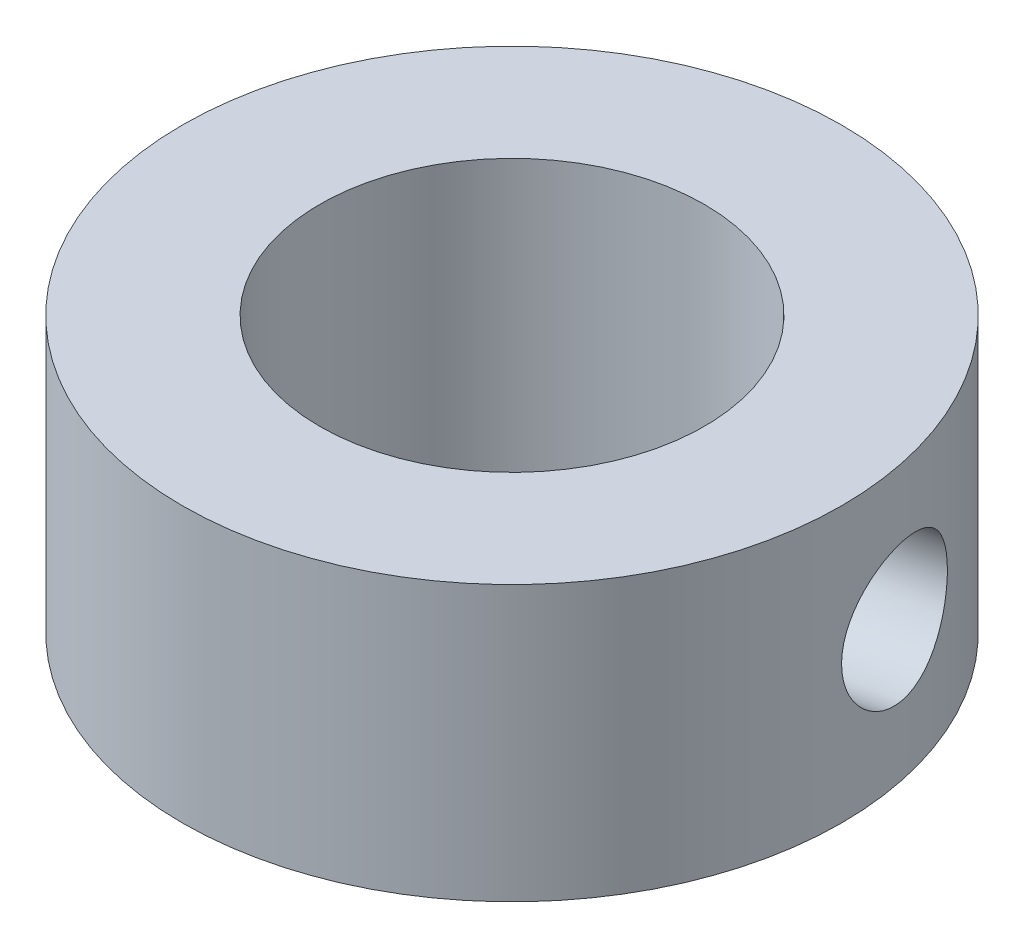
from build123d import *

# Parameters (mm, degrees)
EXTRUDE_1_DEPTH         = 2.5
EXTRUDE_1_DEPTH_BACK    = 2.5
SKETCH_1_R              = 6
SKETCH_1_R_2            = 3.5
HOLE_WIZARD_M3_2_REACH  = 16.131
HOLE_WIZARD_M3_2_BORE_R = 1.25


with BuildPart() as part:
    # 草图1 → 凸台-拉伸1 (new, two sides: drawn at the far end of the back side and taken through both)
    with BuildSketch(Plane(origin=(0, 0, 0), x_dir=(1, 0, 0), z_dir=(0, 1, 0)).offset(-EXTRUDE_1_DEPTH_BACK)):
        with Locations(Location((0, 0, 0), (0, 0, 270))):
            Circle(SKETCH_1_R)
        with Locations(Location((0, 0, 0), (0, 0, 270))):
            Circle(SKETCH_1_R_2, mode=Mode.SUBTRACT)
    extrude(amount=EXTRUDE_1_DEPTH + EXTRUDE_1_DEPTH_BACK)

    # M3 螺纹孔2 bore (on position points) → M3 螺纹孔2 (cut, up to next)
    with BuildSketch(Plane(origin=(5.868868572, 0.005766824, -1.247550275), x_dir=(0.207925045821, 0, 0.978144761945), z_dir=(0.978144761945, 0, -0.207925045821)), mode=Mode.PRIVATE) as hole_wizard_m3_2_sk1:
        Circle(HOLE_WIZARD_M3_2_BORE_R)
    hole_wizard_m3_2_tool1 = extrude(hole_wizard_m3_2_sk1.sketch, amount=-HOLE_WIZARD_M3_2_REACH, mode=Mode.PRIVATE) & part.part
    add(hole_wizard_m3_2_tool1.solids().sort_by_distance((5.868869, 0.005767, -1.24755))[0], mode=Mode.SUBTRACT)


solid = part.part
